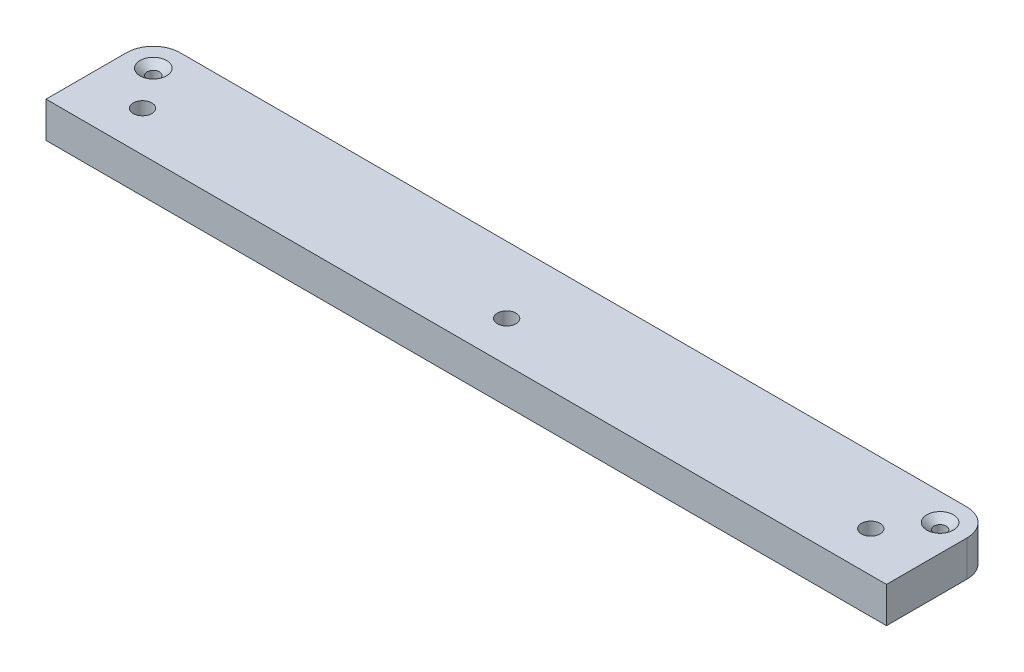
from build123d import *

# Parameters (mm, degrees)
SKETCH1_W           = 298.45
SKETCH1_H           = 38.1
BOSS_EXTRUDE1_DEPTH = 12.7
FILLET1_R           = 9.525
SKETCH2_R           = 3.302
CUT_EXTRUDE1_DEPTH  = 7.9375
SKETCH4_R           = 1.4224
CUT_EXTRUDE2_DEPTH  = 302.140004815
SKETCH5_R           = 2.413
CUT_EXTRUDE3_DEPTH  = 2.921
SKETCH6_R           = 2.1844
CUT_EXTRUDE4_DEPTH  = 302.140004815
CHAMFER1_SIZE       = 2.54
CHAMFER1_SIZE2      = 2.207988314
CUT_EXTRUDE5_START  = -5.08
SKETCH7_R           = 7.239
CUT_EXTRUDE5_DEPTH  = 297.060004815


with BuildPart() as part:
    # Sketch1 → Boss-Extrude1 (new body)
    with BuildSketch(Plane(origin=(0, 0, 0), x_dir=(1, 0, 0), z_dir=(0, 1, 0))):
        with Locations((149.225, 19.05)):
            Rectangle(SKETCH1_W, SKETCH1_H)
    extrude(amount=BOSS_EXTRUDE1_DEPTH)

    # Fillet1
    fillet1_edges = [part.edges().sort_by_distance(p)[0] for p in [
        (0, 6.35, -38.1),
        (298.45, 6.35, -38.1),
    ]]
    fillet(fillet1_edges, radius=FILLET1_R)

    # Sketch2 → Cut-Extrude1 (cut)
    with BuildSketch(Plane(origin=(0, 12.7, 0), x_dir=(1, 0, 0), z_dir=(0, 1, 0))):
        with Locations(Location((19.939, 14.351, 0), (0, 0, 270))):
            Circle(SKETCH2_R)
        with Locations(Location((149.225, 14.351, 0), (0, 0, 270))):
            Circle(SKETCH2_R)
        with Locations(Location((278.511, 14.351, 0), (0, 0, 270))):
            Circle(SKETCH2_R)
    extrude(amount=-CUT_EXTRUDE1_DEPTH, mode=Mode.SUBTRACT)

    # Sketch4 → Cut-Extrude2 (cut, through all)
    with BuildSketch(Plane.XZ):
        with Locations(Location((19.939, -14.351, 0), (0, 0, 270))):
            Circle(SKETCH4_R)
        with Locations(Location((149.225, -14.351, 0), (0, 0, 270))):
            Circle(SKETCH4_R)
        with Locations(Location((278.511, -14.351, 0), (0, 0, 270))):
            Circle(SKETCH4_R)
    extrude(amount=-CUT_EXTRUDE2_DEPTH, mode=Mode.SUBTRACT)

    # Sketch5 → Cut-Extrude3 (cut)
    with BuildSketch(Plane.XZ):
        with Locations(Location((19.939, -14.351, 0), (0, 0, 270))):
            Circle(SKETCH5_R)
        with Locations(Location((149.225, -14.351, 0), (0, 0, 270))):
            Circle(SKETCH5_R)
        with Locations(Location((278.511, -14.351, 0), (0, 0, 270))):
            Circle(SKETCH5_R)
    extrude(amount=-CUT_EXTRUDE3_DEPTH, mode=Mode.SUBTRACT)

    # Sketch6 → Cut-Extrude4 (cut, through all)
    with BuildSketch(Plane(origin=(0, 12.7, 0), x_dir=(1, 0, 0), z_dir=(0, 1, 0))):
        with BuildLine():
            ThreePointArc((286.7406, 28.575), (288.925, 26.3906), (291.1094, 28.575))
            Line((291.1094, 28.575), (286.7406, 28.575))
        make_face()
        with BuildLine():
            Line((286.7406, 28.575), (291.1094, 28.575))
            ThreePointArc((291.1094, 28.575), (288.925, 30.7594), (286.7406, 28.575))
        make_face()
        with Locations(Location((9.525, 28.575, 0), (0, 0, 270))):
            Circle(SKETCH6_R)
    extrude(amount=-CUT_EXTRUDE4_DEPTH, mode=Mode.SUBTRACT)

    # Chamfer1
    chamfer1_edges = [part.edges().sort_by_distance(p)[0] for p in [
        (291.1094, 12.7, -28.575),
        (9.525, 12.7, -30.7594),
    ]]
    chamfer1_side = [part.faces().sort_by_distance(p)[0] for p in [
        (149.225, 12.7, -19.008778326),
    ]]
    chamfer(chamfer1_edges, length=CHAMFER1_SIZE, length2=CHAMFER1_SIZE2, reference=chamfer1_side[0])

    # Sketch7 → Cut-Extrude5 (cut, through all)
    with BuildSketch(Plane(origin=(0, 12.7, 0), x_dir=(1, 0, 0), z_dir=(0, 1, 0)).offset(CUT_EXTRUDE5_START)):
        with Locations(Location((149.225, 28.575, 0), (0, 0, 270))):
            Circle(SKETCH7_R)
    extrude(amount=-CUT_EXTRUDE5_DEPTH, mode=Mode.SUBTRACT)


solid = part.part
